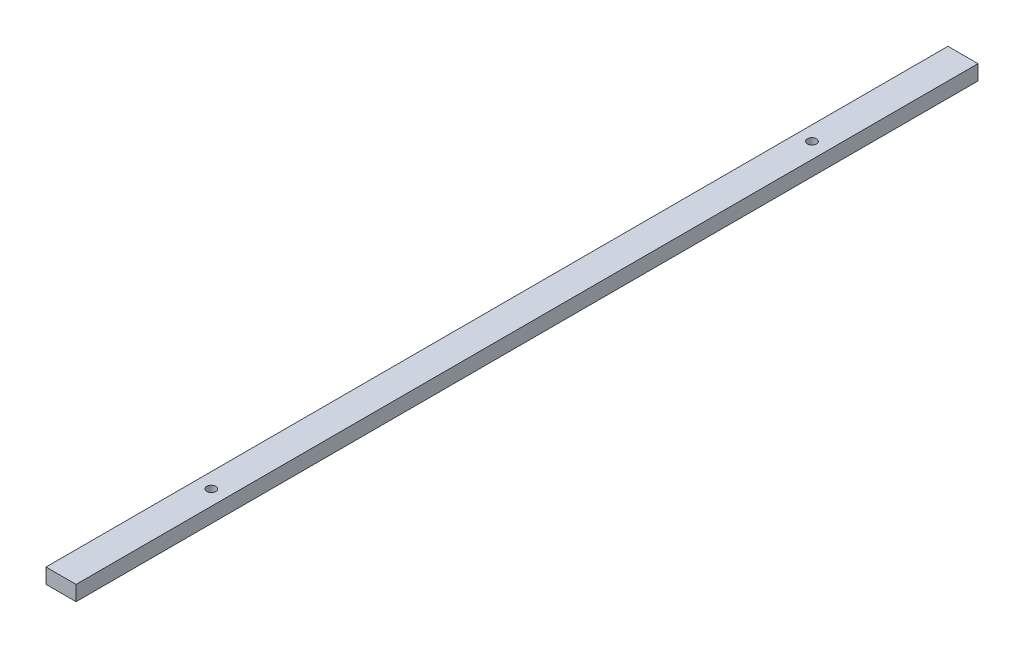
from build123d import *

# Parameters (mm, degrees)
SKETCH1_W               = 10
SKETCH1_H               = 5
BOSS_EXTRUDE1_DEPTH     = 300
CUT_EXTRUDE1_DEPTH      = 301.087278188
CUT_EXTRUDE1_DEPTH_BACK = 301.087278188
SKETCH2_R               = 1.5


with BuildPart() as part:
    # Sketch1 → Boss-Extrude1 (new body)
    with BuildSketch(Plane.XY):
        with Locations((0.232067511, -2.120253165)):
            Rectangle(SKETCH1_W, SKETCH1_H)
    extrude(amount=BOSS_EXTRUDE1_DEPTH)

    # Sketch2 → Cut-Extrude1 (cut, two sides: drawn at the far end of the back side and taken through both)
    with BuildSketch(Plane(origin=(0, 0.379746835, 0), x_dir=(1, 0, 0), z_dir=(0, 1, 0)).offset(-CUT_EXTRUDE1_DEPTH_BACK)):
        with Locations(Location((0.232067511, -250, 0), (0, 0, 270))):
            Circle(SKETCH2_R)
        with Locations(Location((0, -50, 0), (0, 0, 270))):
            Circle(SKETCH2_R)
    extrude(amount=CUT_EXTRUDE1_DEPTH + CUT_EXTRUDE1_DEPTH_BACK, mode=Mode.SUBTRACT)


solid = part.part
